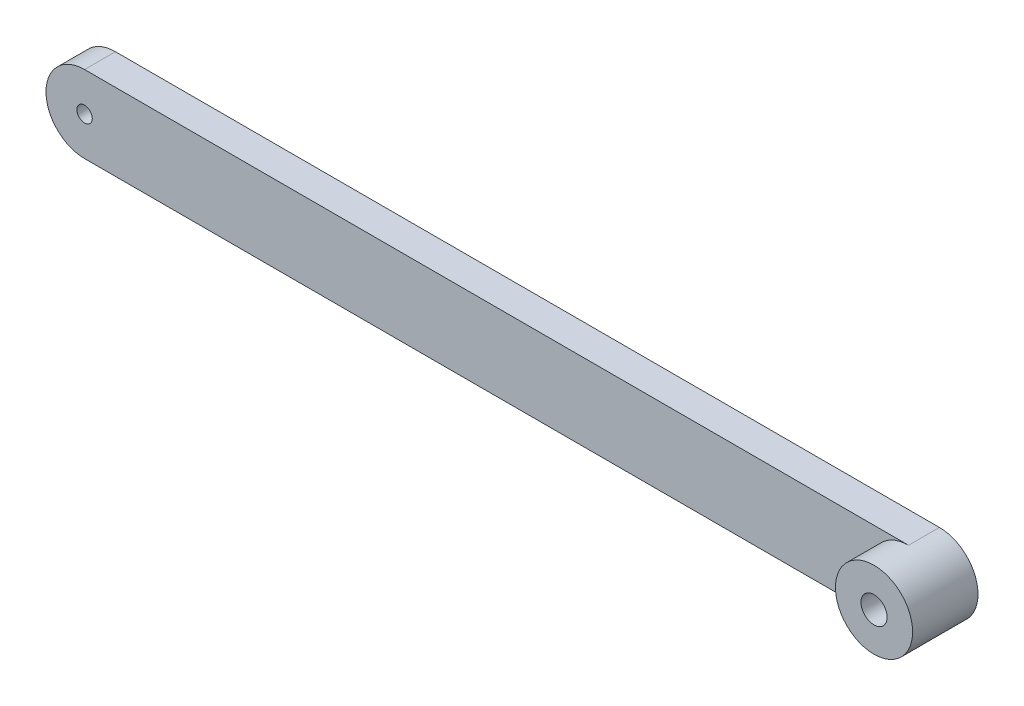
from build123d import *

# Parameters (mm, degrees)
RESSALTO_EXTRUS_O1_DEPTH = 2
ESBO_O3_R                = 2.5
RESSALTO_EXTRUS_O2_DEPTH = 2.24
ESBO_O2_R                = 0.5
CORTE_EXTRUS_O1_DEPTH    = 30.616880744
ESBO_O4_R                = 0.85
CORTE_EXTRUS_O2_DEPTH    = 30.616880744


with BuildPart() as part:
    # Esboço1 → Ressalto-extrusão1 (new body)
    with BuildSketch(Plane.XY):
        with BuildLine():
            Line((-26.705, 2.5), (26.705, 2.5))
            ThreePointArc((26.705, 2.5), (29.205, 0), (26.705, -2.5))
            Line((26.705, -2.5), (-26.705, -2.5))
            ThreePointArc((-26.705, -2.5), (-29.205, 0), (-26.705, 2.5))
        make_face()
    extrude(amount=RESSALTO_EXTRUS_O1_DEPTH)

    # Esboço3 → Ressalto-extrusão2 (add)
    with BuildSketch(Plane.XY.offset(2)):
        with Locations(Location((26.705, 0, 0), (0, 0, 90))):
            Circle(ESBO_O3_R)
    extrude(amount=RESSALTO_EXTRUS_O2_DEPTH)

    # Esboço2 → Corte-extrusão1 (cut, through all)
    with BuildSketch(Plane(origin=(0, 0, 0), x_dir=(-1, 0, 0), z_dir=(0, 0, -1))):
        with Locations((26.705, 0)):
            Circle(ESBO_O2_R)
    extrude(amount=-CORTE_EXTRUS_O1_DEPTH, mode=Mode.SUBTRACT)

    # Esboço4 → Corte-extrusão2 (cut, through all)
    with BuildSketch(Plane.XY.offset(4.24)):
        with Locations((26.705, 0)):
            Circle(ESBO_O4_R)
    extrude(amount=-CORTE_EXTRUS_O2_DEPTH, mode=Mode.SUBTRACT)


solid = part.part
